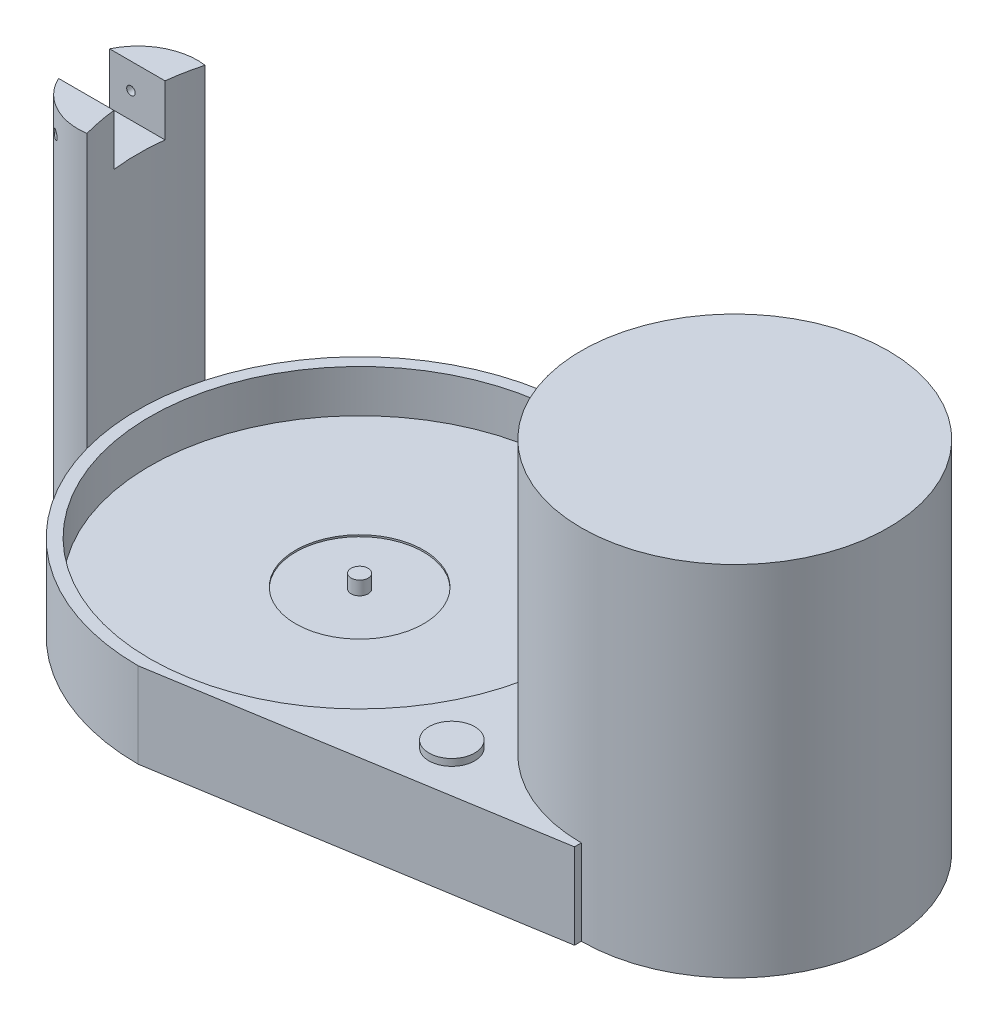
from build123d import *

# Parameters (mm, degrees)
BOSS_EXTRUDE1_DEPTH     = 210
BOSS_EXTRUDE2_DEPTH     = 50
BOSS_EXTRUDE3_DEPTH     = 210
SKETCH4_R               = 123
CUT_EXTRUDE1_DEPTH      = 25
CUT_EXTRUDE2_START      = -30
CUT_EXTRUDE2_DEPTH      = 30
CUT_EXTRUDE3_DEPTH      = 402.528330258
CUT_EXTRUDE3_DEPTH_BACK = 402.528330258
SKETCH8_R               = 2.5
SKETCH9_R               = 37.5
CUT_EXTRUDE4_DEPTH      = 1
SKETCH10_R              = 5
BOSS_EXTRUDE4_DEPTH     = 8
SKETCH11_R              = 13.401847331
BOSS_EXTRUDE5_DEPTH     = 4


with BuildPart() as part:
    # Sketch3 → Boss-Extrude1 (new body)
    with BuildSketch(Plane(origin=(0, 0, 0), x_dir=(1, 0, 0), z_dir=(0, 1, 0))):
        with BuildLine():
            ThreePointArc((220, 90), (130, 0), (220, -90))
            ThreePointArc((220, -90), (283.639610307, -63.639610307), (310, 0))
            ThreePointArc((310, 0), (283.639610307, 63.639610307), (220, 90))
        make_face()
    extrude(amount=BOSS_EXTRUDE1_DEPTH)

    # Sketch3<3> → Boss-Extrude2 (add)
    with BuildSketch(Plane(origin=(0, 0, 0), x_dir=(1, 0, 0), z_dir=(0, 1, 0))):
        with BuildLine():
            ThreePointArc((-125.288461538, -34.681427383), (-78.71281484, -103.461552182), (0, -130))
            Line((0, -130), (220, -94))
            Line((220, -94), (220, -90))
            ThreePointArc((220, -90), (130, 0), (220, 90))
            Line((220, 90), (220, 94))
            Line((220, 94), (0, 130))
            ThreePointArc((0, 130), (-78.71281484, 103.461552182), (-125.288461538, 34.681427383))
            ThreePointArc((-125.288461538, 34.681427383), (-130, 0), (-125.288461538, -34.681427383))
        make_face()
    extrude(amount=BOSS_EXTRUDE2_DEPTH)

    # Sketch3<4> → Boss-Extrude3 (add)
    with BuildSketch(Plane(origin=(0, 0, 0), x_dir=(1, 0, 0), z_dir=(0, 1, 0))):
        with BuildLine():
            ThreePointArc((-125.288461538, 34.681427383), (-165, 0), (-125.288461538, -34.681427383))
            ThreePointArc((-125.288461538, -34.681427383), (-130, 0), (-125.288461538, 34.681427383))
        make_face()
    extrude(amount=BOSS_EXTRUDE3_DEPTH)

    # Sketch4 → Cut-Extrude1 (cut)
    with BuildSketch(Plane(origin=(0, 50, 0), x_dir=(1, 0, 0), z_dir=(0, 1, 0))):
        Circle(SKETCH4_R)
    extrude(amount=-CUT_EXTRUDE1_DEPTH, mode=Mode.SUBTRACT)

    # Sketch6 → Cut-Extrude2 (cut)
    with BuildSketch(Plane(origin=(0, 210, 0), x_dir=(1, 0, 0), z_dir=(0, 1, 0)).offset(CUT_EXTRUDE2_START)):
        with BuildLine():
            Line((-161.622776602, 15), (-129.131715701, 15))
            ThreePointArc((-129.131715701, 15), (-130, 0), (-129.131715701, -15))
            Line((-129.131715701, -15), (-161.622776602, -15))
            ThreePointArc((-161.622776602, -15), (-165, 0), (-161.622776602, 15))
        make_face()
    extrude(amount=CUT_EXTRUDE2_DEPTH, mode=Mode.SUBTRACT)

    # Sketch8 → Cut-Extrude3 (cut, two sides: drawn at the far end of the back side and taken through both)
    with BuildSketch(Plane(origin=(0, 0, 15), x_dir=(-1, 0, 0), z_dir=(0, 0, -1)).offset(-CUT_EXTRUDE3_DEPTH_BACK)):
        with Locations((149.131715701, 195)):
            Circle(SKETCH8_R)
    extrude(amount=CUT_EXTRUDE3_DEPTH + CUT_EXTRUDE3_DEPTH_BACK, mode=Mode.SUBTRACT)

    # Sketch9 → Cut-Extrude4 (cut)
    with BuildSketch(Plane(origin=(0, 25, 0), x_dir=(1, 0, 0), z_dir=(0, 1, 0))):
        Circle(SKETCH9_R)
    extrude(amount=-CUT_EXTRUDE4_DEPTH, mode=Mode.SUBTRACT)

    # Sketch10 → Boss-Extrude4 (add)
    with BuildSketch(Plane(origin=(0, 24, 0), x_dir=(1, 0, 0), z_dir=(0, 1, 0))):
        Circle(SKETCH10_R)
    extrude(amount=BOSS_EXTRUDE4_DEPTH)

    # Sketch11 → Boss-Extrude5 (add)
    with BuildSketch(Plane(origin=(0, 50, 0), x_dir=(1, 0, 0), z_dir=(0, 1, 0))):
        with Locations((133.690962694, -79.625060242)):
            Circle(SKETCH11_R)
    extrude(amount=BOSS_EXTRUDE5_DEPTH)


solid = part.part
